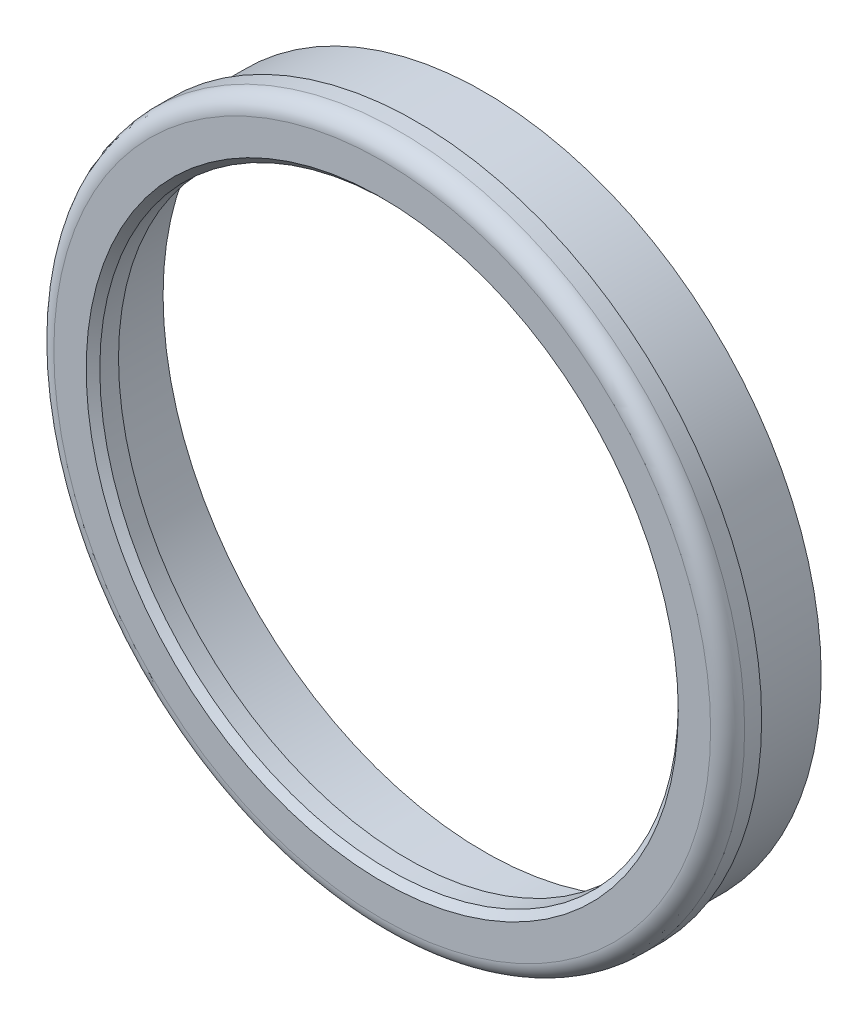
from build123d import *

# Parameters (mm, degrees)
SKETCH1_R           = 20.3
SKETCH1_R_2         = 17
BOSS_EXTRUDE1_DEPTH = 2
SKETCH2_R           = 19.8
SKETCH2_R_2         = 18.88
BOSS_EXTRUDE2_DEPTH = 4
CHAMFER2_SIZE       = 0.4
CUT_EXTRUDE1_START  = -0.5
SKETCH3_R           = 18.88
CUT_EXTRUDE1_DEPTH  = 0.5
FILLET1_R           = 1


with BuildPart() as part:
    # Sketch1 → Boss-Extrude1 (new body)
    with BuildSketch(Plane.XY):
        Circle(SKETCH1_R)
        Circle(SKETCH1_R_2, mode=Mode.SUBTRACT)
    extrude(amount=-BOSS_EXTRUDE1_DEPTH)

    # Sketch2 → Boss-Extrude2 (add)
    with BuildSketch(Plane(origin=(0, 0, -2), x_dir=(-1, 0, 0), z_dir=(0, 0, -1))):
        with Locations(Location((0, 0, 0), (0, 0, 180))):
            Circle(SKETCH2_R)
        Circle(SKETCH2_R_2, mode=Mode.SUBTRACT)
    extrude(amount=BOSS_EXTRUDE2_DEPTH)

    # Chamfer2
    chamfer2_edges = [part.edges().sort_by_distance(p)[0] for p in [
        (-17, 0, 0),
    ]]
    chamfer(chamfer2_edges, length=CHAMFER2_SIZE)

    # Sketch3 → Cut-Extrude1 (cut)
    with BuildSketch(Plane(origin=(0, 0, -2), x_dir=(-1, 0, 0), z_dir=(0, 0, -1)).offset(CUT_EXTRUDE1_START)):
        Circle(SKETCH3_R)
    extrude(amount=CUT_EXTRUDE1_DEPTH, mode=Mode.SUBTRACT)

    # Fillet1
    fillet1_edges = [part.edges().sort_by_distance(p)[0] for p in [
        (-20.3, 0, 0),
    ]]
    fillet(fillet1_edges, radius=FILLET1_R)


solid = part.part
